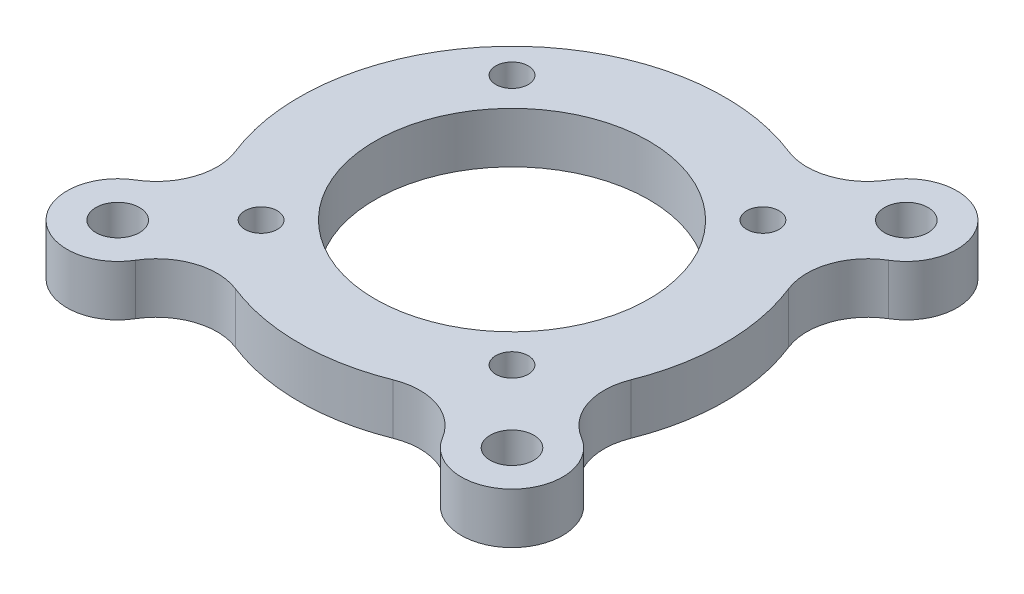
from build123d import *

# Parameters (mm, degrees)
SKETCH_1_R      = 13.5
SKETCH_1_R_2    = 1.6
SKETCH_1_R_3    = 2.15
EXTRUDE_1_DEPTH = 5


with BuildPart() as part:
    # ｽｹｯﾁ1 → ﾎﾞｽ - 押し出し1 (new body)
    with BuildSketch(Plane(origin=(0, 0, 0), x_dir=(1, 0, 0), z_dir=(0, 1, 0))):
        with BuildLine():
            ThreePointArc((15.151339784, 22.006829374), (11.924552334, 19.398069264), (7.776551803, 19.507056212))
            ThreePointArc((7.776551803, 19.507056212), (-14.849242405, 14.849242405), (-19.507056212, -7.776551803))
            ThreePointArc((-19.507056212, -7.776551803), (-19.398069264, -11.924552334), (-22.006829374, -15.151339784))
            ThreePointArc((-22.006829374, -15.151339784), (-22.980970389, -22.980970389), (-15.151339784, -22.006829374))
            ThreePointArc((-15.151339784, -22.006829374), (-11.924552334, -19.398069264), (-7.776551803, -19.507056212))
            ThreePointArc((-7.776551803, -19.507056212), (0, -21), (7.776551803, -19.507056212))
            ThreePointArc((7.776551803, -19.507056212), (11.924552334, -19.398069264), (15.151339784, -22.006829374))
            ThreePointArc((15.151339784, -22.006829374), (22.980970389, -22.980970389), (22.006829374, -15.151339784))
            ThreePointArc((22.006829374, -15.151339784), (19.398069264, -11.924552334), (19.507056212, -7.776551803))
            ThreePointArc((19.507056212, -7.776551803), (21, 0), (19.507056212, 7.776551803))
            ThreePointArc((19.507056212, 7.776551803), (19.398069264, 11.924552334), (22.006829374, 15.151339784))
            ThreePointArc((22.006829374, 15.151339784), (22.980970389, 22.980970389), (15.151339784, 22.006829374))
        make_face()
        with Locations(Location((0, 0, 0), (0, 0, 270))):
            Circle(SKETCH_1_R, mode=Mode.SUBTRACT)
        with Locations(Location((12.374368671, 12.374368671, 0), (0, 0, 270))):
            Circle(SKETCH_1_R_2, mode=Mode.SUBTRACT)
        with Locations(Location((12.374368671, -12.374368671, 0), (0, 0, 270))):
            Circle(SKETCH_1_R_2, mode=Mode.SUBTRACT)
        with Locations(Location((-12.374368671, -12.374368671, 0), (0, 0, 270))):
            Circle(SKETCH_1_R_2, mode=Mode.SUBTRACT)
        with Locations(Location((-12.374368671, 12.374368671, 0), (0, 0, 270))):
            Circle(SKETCH_1_R_2, mode=Mode.SUBTRACT)
        with Locations(Location((19.445436483, 19.445436483, 0), (0, 0, 270))):
            Circle(SKETCH_1_R_3, mode=Mode.SUBTRACT)
        with Locations(Location((19.445436483, -19.445436483, 0), (0, 0, 270))):
            Circle(SKETCH_1_R_3, mode=Mode.SUBTRACT)
        with Locations(Location((-19.445436483, -19.445436483, 0), (0, 0, 270))):
            Circle(SKETCH_1_R_3, mode=Mode.SUBTRACT)
    extrude(amount=EXTRUDE_1_DEPTH)


solid = part.part
